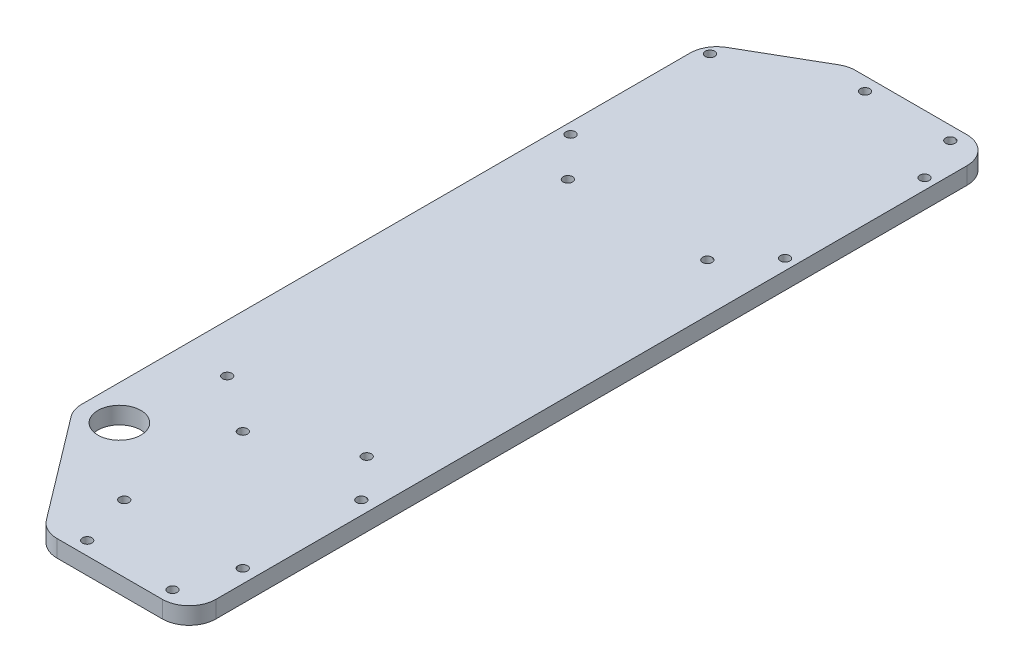
from build123d import *

# Parameters (mm, degrees)
SKETCH1_R           = 8
SKETCH1_R_2         = 1.75
BOSS_EXTRUDE1_DEPTH = 6.35
FILLET1_R           = 10


with BuildPart() as part:
    # Sketch1 → Boss-Extrude1 (new body)
    with BuildSketch(Plane(origin=(0, 0, 0), x_dir=(1, 0, 0), z_dir=(0, 1, 0))):
        Polygon((0, 44.633081493), (33.8, 0), (88, 0), (88, 300), (33.8, 300), (0, 280.510901235), align=None)
        with Locations(Location((13, 49, 0), (0, 0, 270))):
            Circle(SKETCH1_R, mode=Mode.SUBTRACT)
        with Locations(Location((38.8, 25, 0), (0, 0, 270))):
            Circle(SKETCH1_R_2, mode=Mode.SUBTRACT)
        with Locations(Location((38.8, 69.2, 0), (0, 0, 270))):
            Circle(SKETCH1_R_2, mode=Mode.SUBTRACT)
        with Locations(Location((18, 84.2, 0), (0, 0, 270))):
            Circle(SKETCH1_R_2, mode=Mode.SUBTRACT)
        with Locations(Location((45, 5, 0), (0, 0, 270))):
            Circle(SKETCH1_R_2, mode=Mode.SUBTRACT)
        with Locations(Location((76.8, 5, 0), (0, 0, 270))):
            Circle(SKETCH1_R_2, mode=Mode.SUBTRACT)
        with Locations(Location((83, 25, 0), (0, 0, 270))):
            Circle(SKETCH1_R_2, mode=Mode.SUBTRACT)
        with Locations(Location((83, 69.2, 0), (0, 0, 270))):
            Circle(SKETCH1_R_2, mode=Mode.SUBTRACT)
        with Locations(Location((70, 84.2, 0), (0, 0, 270))):
            Circle(SKETCH1_R_2, mode=Mode.SUBTRACT)
        with Locations(Location((18, 211.2, 0), (0, 0, 270))):
            Circle(SKETCH1_R_2, mode=Mode.SUBTRACT)
        with Locations(Location((4, 226.2, 0), (0, 0, 270))):
            Circle(SKETCH1_R_2, mode=Mode.SUBTRACT)
        with Locations(Location((4, 278.2, 0), (0, 0, 270))):
            Circle(SKETCH1_R_2, mode=Mode.SUBTRACT)
        with Locations(Location((70, 211.2, 0), (0, 0, 270))):
            Circle(SKETCH1_R_2, mode=Mode.SUBTRACT)
        with Locations(Location((45, 295, 0), (0, 0, 270))):
            Circle(SKETCH1_R_2, mode=Mode.SUBTRACT)
        with Locations(Location((84, 226.2, 0), (0, 0, 270))):
            Circle(SKETCH1_R_2, mode=Mode.SUBTRACT)
        with Locations(Location((76.8, 295, 0), (0, 0, 270))):
            Circle(SKETCH1_R_2, mode=Mode.SUBTRACT)
        with Locations(Location((84, 278.2, 0), (0, 0, 270))):
            Circle(SKETCH1_R_2, mode=Mode.SUBTRACT)
    extrude(amount=BOSS_EXTRUDE1_DEPTH)

    # Fillet1
    fillet1_edges = [part.edges().sort_by_distance(p)[0] for p in [
        (88, 3.175, -300),
        (88, 3.175, 0),
        (33.8, 3.175, 0),
        (0, 3.175, -44.633081493),
        (0, 3.175, -280.510901235),
        (33.8, 3.175, -300),
    ]]
    fillet(fillet1_edges, radius=FILLET1_R)


solid = part.part
